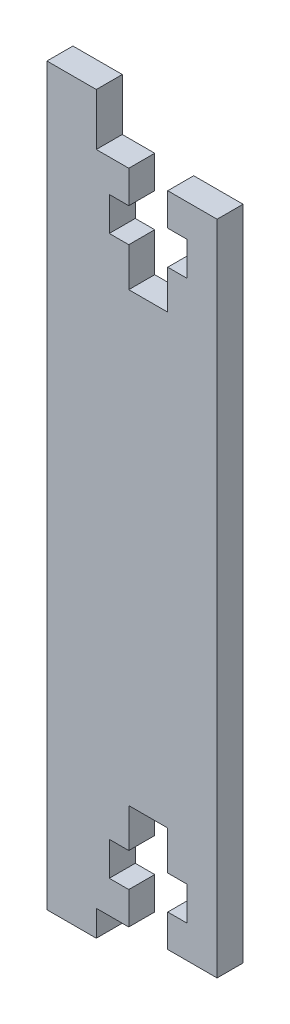
from build123d import *

# Parameters (mm, degrees)
EXTRUDE_1_DEPTH = 2


with BuildPart() as part:
    # 草图1 → 凸台-拉伸1 (new body)
    with BuildSketch(Plane.XY):
        Polygon((-4.017142857, 28.445714286), (-7.817142857, 28.445714286), (-7.817142857, 24.445714286), (-7.817142857, -26.154285714), (-7.817142857, -28.154285714), (-4.017142857, -28.154285714), (-4.017142857, -26.154285714), (-1.517142857, -26.154285714), (-1.517142857, -23.654285714), (-3.017142857, -23.654285714), (-3.017142857, -21.054285714), (-1.517142857, -21.054285714), (-1.517142857, -18.054285714), (1.482857143, -18.054285714), (1.482857143, -21.054285714), (2.982857143, -21.054285714), (2.982857143, -23.654285714), (1.482857143, -23.654285714), (1.482857143, -26.154285714), (5.282857143, -26.154285714), (5.282857143, 24.445714286), (1.482857143, 24.445714286), (1.482857143, 21.945714286), (2.982857143, 21.945714286), (2.982857143, 19.345714286), (1.482857143, 19.345714286), (1.482857143, 16.345714286), (-1.517142857, 16.345714286), (-1.517142857, 19.345714286), (-3.017142857, 19.345714286), (-3.017142857, 21.945714286), (-1.517142857, 21.945714286), (-1.517142857, 24.445714286), (-4.017142857, 24.445714286), align=None)
    extrude(amount=EXTRUDE_1_DEPTH)


solid = part.part
